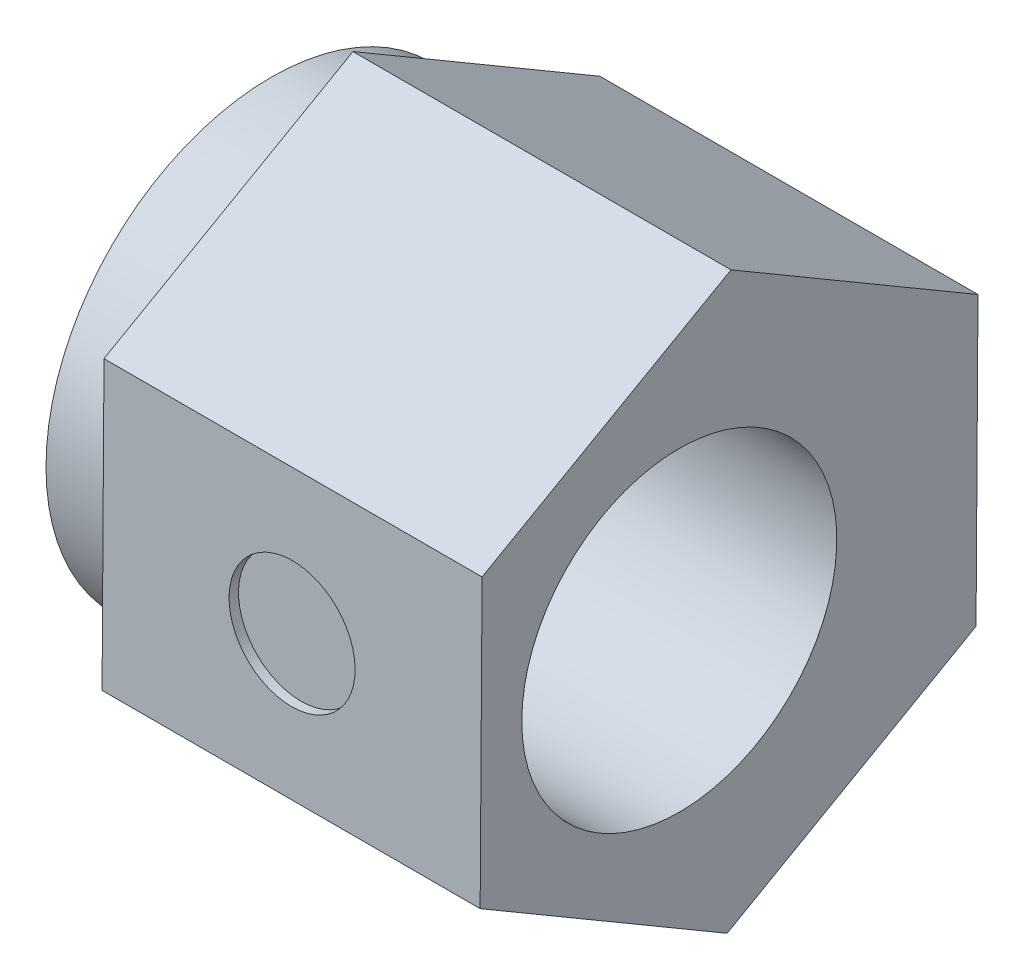
from build123d import *

# Parameters (mm, degrees)
BOSS_EXTRUDE1_DEPTH = 6
SKETCH4_R           = 3.57
BOSS_EXTRUDE2_DEPTH = 1.27
SKETCH3_R           = 2.5
CUT_EXTRUDE1_DEPTH  = 10.439442655
SKETCH5_R           = 1
CUT_EXTRUDE3_DEPTH  = 0.15


with BuildPart() as part:
    # Sketch2 → Boss-Extrude1 (new body)
    with BuildSketch(Plane(origin=(0, 0, 0), x_dir=(0, 0, -1), z_dir=(1, 0, 0))):
        Polygon((3.919437566, -2.29861752), (3.950379949, 2.245023741), (0.030942383, 4.54364126), (-3.919437566, 2.29861752), (-3.950379949, -2.245023741), (-0.030942383, -4.54364126), align=None)
    extrude(amount=BOSS_EXTRUDE1_DEPTH)

    # Sketch4 → Boss-Extrude2 (add)
    with BuildSketch(Plane.ZY):
        with Locations(Location((0, 0, 0), (0, 0, 180))):
            Circle(SKETCH4_R)
    extrude(amount=BOSS_EXTRUDE2_DEPTH)

    # Sketch3 → Cut-Extrude1 (cut, through all)
    with BuildSketch(Plane.ZY.offset(1.27)):
        with Locations((0.79, 0)):
            Circle(SKETCH3_R)
    extrude(amount=-CUT_EXTRUDE1_DEPTH, mode=Mode.SUBTRACT)

    # Sketch5 → Cut-Extrude3 (cut)
    with BuildSketch(Plane(origin=(0, 0.02679689, 3.934908757), x_dir=(1, 0, 0), z_dir=(0, -0.006809882993303443, -0.9999768124779782))):
        with Locations(Location((3, 0, 0), (0, 0, 90))):
            Circle(SKETCH5_R)
    extrude(amount=CUT_EXTRUDE3_DEPTH, mode=Mode.SUBTRACT)


solid = part.part
